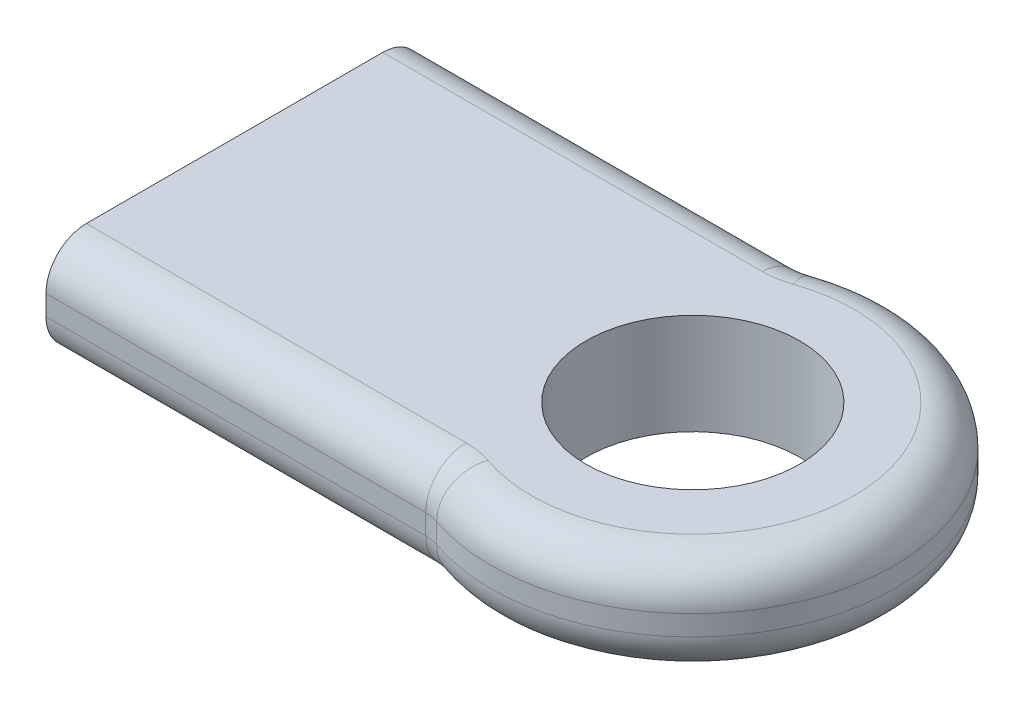
from build123d import *

# Parameters (mm, degrees)
CROQUIS1_R              = 5.3
SALIENTE_EXTRUIR1_DEPTH = 2.5
CROQUIS2_W              = 13.1
CROQUIS2_H              = 2
CORTAR_EXTRUIR1_DEPTH   = 15
REDONDEO1_R             = 2


with BuildPart() as part:
    # Croquis1 → Saliente-Extruir1 (new, symmetric)
    with BuildSketch(Plane(origin=(0, 0, 0), x_dir=(1, 0, 0), z_dir=(0, 1, 0))):
        with BuildLine():
            Line((-22.725121358, 9.35), (-3.546477125, 9.35))
            ThreePointArc((-3.546477125, 9.35), (10, 0), (-3.546477125, -9.35))
            Line((-3.546477125, -9.35), (-22.725121358, -9.35))
            Line((-22.725121358, -9.35), (-22.725121358, 9.35))
        make_face()
        with Locations(Location((0, 0, 0), (0, 0, 270))):
            Circle(CROQUIS1_R, mode=Mode.SUBTRACT)
    extrude(amount=SALIENTE_EXTRUIR1_DEPTH, both=True)

    # Croquis2 → Cortar-Extruir1 (cut)
    with BuildSketch(Plane.ZY.offset(22.725121358)):
        Rectangle(CROQUIS2_W, CROQUIS2_H)
    extrude(amount=-CORTAR_EXTRUIR1_DEPTH, mode=Mode.SUBTRACT)

    # Redondeo1
    redondeo1_edges = [part.edges().sort_by_distance(p)[0] for p in [
        (10, 2.5, 0),
        (-13.135799242, 2.5, -9.35),
        (-13.135799242, -2.5, -9.35),
        (10, -2.5, 0),
        (-13.135799242, -2.5, 9.35),
        (-13.135799242, 2.5, 9.35),
        (-3.546477125, 0, -9.35),
        (-3.546477125, 0, 9.35),
    ]]
    fillet(redondeo1_edges, radius=REDONDEO1_R)


solid = part.part
